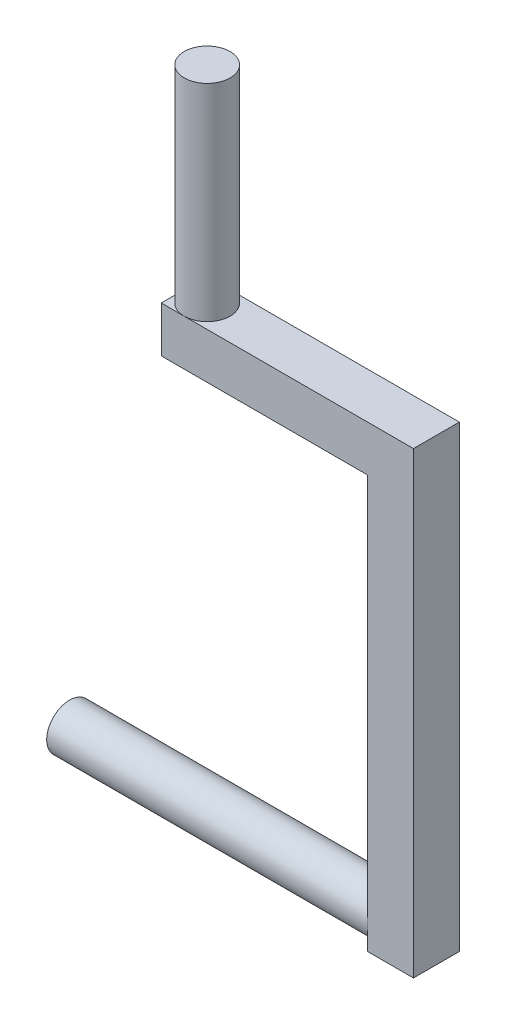
from build123d import *

# Parameters (mm, degrees)
SKETCH2_R           = 6.35
BOSS_EXTRUDE1_DEPTH = 57.15
SKETCH4_W           = 69.85
SKETCH4_H           = 12.7
BOSS_EXTRUDE6_DEPTH = 12.7
SKETCH8_W           = 12.7
SKETCH8_H           = 12.7
BOSS_EXTRUDE7_DEPTH = 114.3
SKETCH9_R           = 6.35
BOSS_EXTRUDE8_DEPTH = 88.9


with BuildPart() as part:
    # Sketch2 → Boss-Extrude1 (new body)
    with BuildSketch(Plane(origin=(0, 0, 0), x_dir=(1, 0, 0), z_dir=(0, 1, 0))):
        with Locations(Location((0, 0, 0), (0, 0, 270))):
            Circle(SKETCH2_R)
    extrude(amount=-BOSS_EXTRUDE1_DEPTH)

    # Sketch4 → Boss-Extrude6 (add)
    with BuildSketch(Plane.XZ.offset(57.15)):
        with Locations((28.575, 0)):
            Rectangle(SKETCH4_W, SKETCH4_H)
    extrude(amount=BOSS_EXTRUDE6_DEPTH)

    # Sketch8 → Boss-Extrude7 (add)
    with BuildSketch(Plane.XZ.offset(69.85)):
        with Locations((57.15, 0)):
            Rectangle(SKETCH8_W, SKETCH8_H)
    extrude(amount=BOSS_EXTRUDE7_DEPTH)

    # Sketch9 → Boss-Extrude8 (add)
    with BuildSketch(Plane.ZY.offset(-50.8)):
        with Locations((0, -177.8)):
            Circle(SKETCH9_R)
    extrude(amount=BOSS_EXTRUDE8_DEPTH)


solid = part.part
